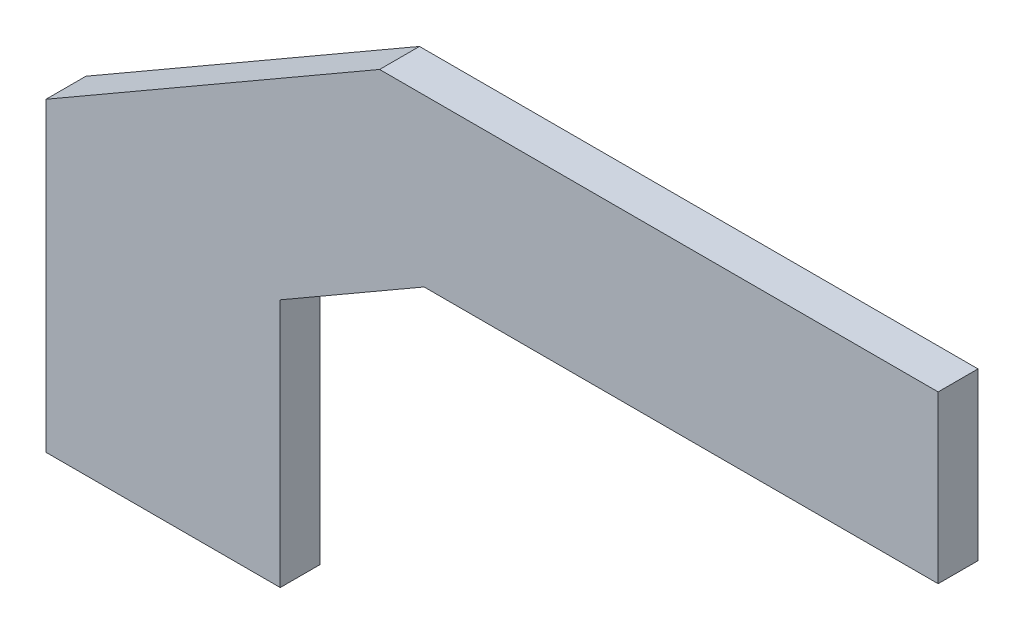
from build123d import *

# Parameters (mm, degrees)
BOSS_EXTRUDE1_DEPTH = 0.12


with BuildPart() as part:
    # Sketch1 → Boss-Extrude1 (new, symmetric)
    with BuildSketch(Plane.XY):
        Polygon((0, 0), (1.41, 0), (1.41, 1.5), (2.276025404, 2), (5.37, 2), (5.37, 3), (2.008076211, 3), (0, 1.840636659), align=None)
    extrude(amount=BOSS_EXTRUDE1_DEPTH, both=True)


solid = part.part
